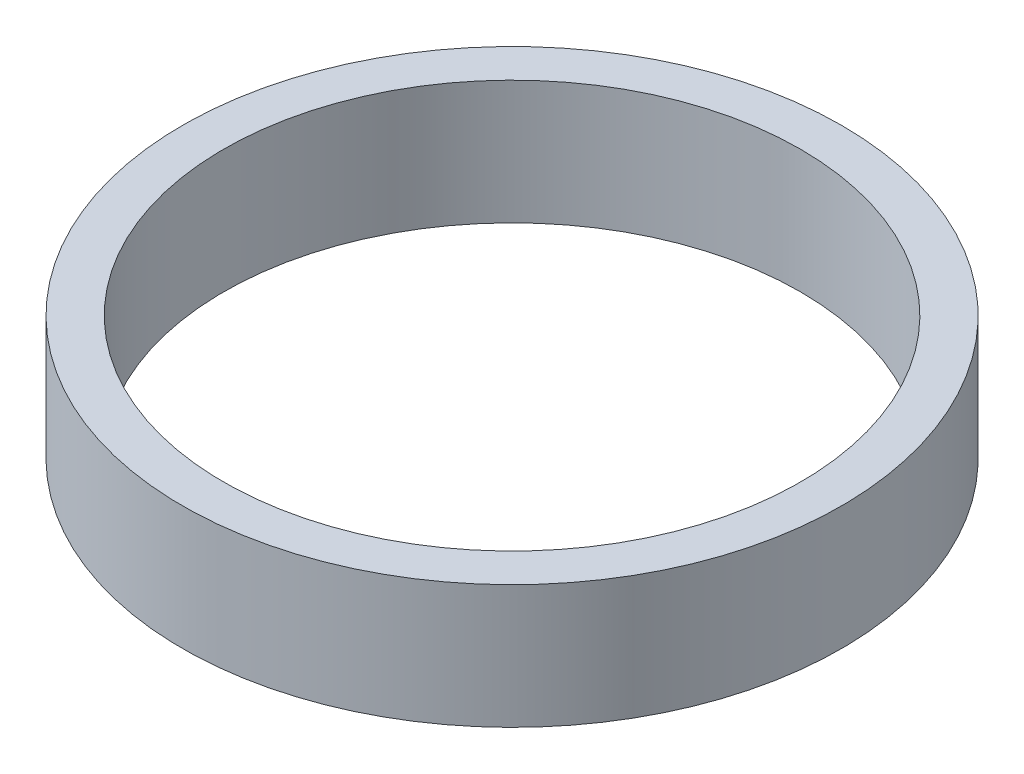
from build123d import *

# Parameters (mm, degrees)
SKETCH2_R           = 20.32
SKETCH2_R_2         = 17.78
BOSS_EXTRUDE1_DEPTH = 7.62


with BuildPart() as part:
    # Sketch2 → Boss-Extrude1 (new body)
    with BuildSketch(Plane(origin=(0, 0, 0), x_dir=(1, 0, 0), z_dir=(0, 1, 0))):
        with Locations(Location((0, 0, 0), (0, 0, 90))):
            Circle(SKETCH2_R)
        with Locations(Location((0, 0, 0), (0, 0, 90))):
            Circle(SKETCH2_R_2, mode=Mode.SUBTRACT)
    extrude(amount=BOSS_EXTRUDE1_DEPTH)


solid = part.part
